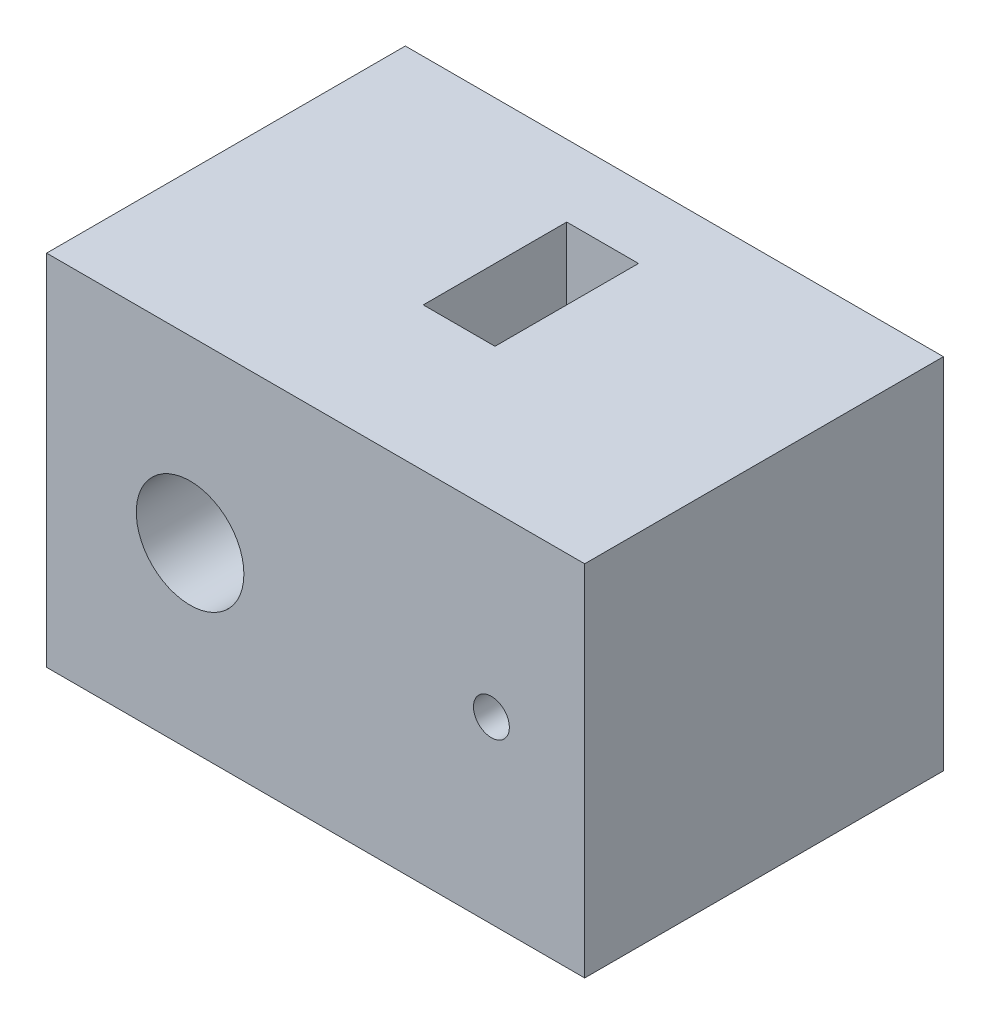
from build123d import *

# Parameters (mm, degrees)
SKETCH1_W           = 75
SKETCH1_H           = 50
SKETCH1_R           = 7.5
SKETCH1_R_2         = 2.5
BOSS_EXTRUDE1_DEPTH = 50
SKETCH2_W           = 10
SKETCH2_H           = 20
CUT_EXTRUDE1_DEPTH  = 104.07764064


with BuildPart() as part:
    # Sketch1 → Boss-Extrude1 (new body)
    with BuildSketch(Plane.XY):
        with Locations((37.5, 25)):
            Rectangle(SKETCH1_W, SKETCH1_H)
        with Locations((20, 25)):
            Circle(SKETCH1_R, mode=Mode.SUBTRACT)
        with Locations((62, 25)):
            Circle(SKETCH1_R_2, mode=Mode.SUBTRACT)
    extrude(amount=BOSS_EXTRUDE1_DEPTH)

    # Sketch2 → Cut-Extrude1 (cut, through all)
    with BuildSketch(Plane(origin=(0, 50, 0), x_dir=(1, 0, 0), z_dir=(0, 1, 0))):
        with Locations((37.5, -20)):
            Rectangle(SKETCH2_W, SKETCH2_H)
    extrude(amount=-CUT_EXTRUDE1_DEPTH, mode=Mode.SUBTRACT)


solid = part.part
